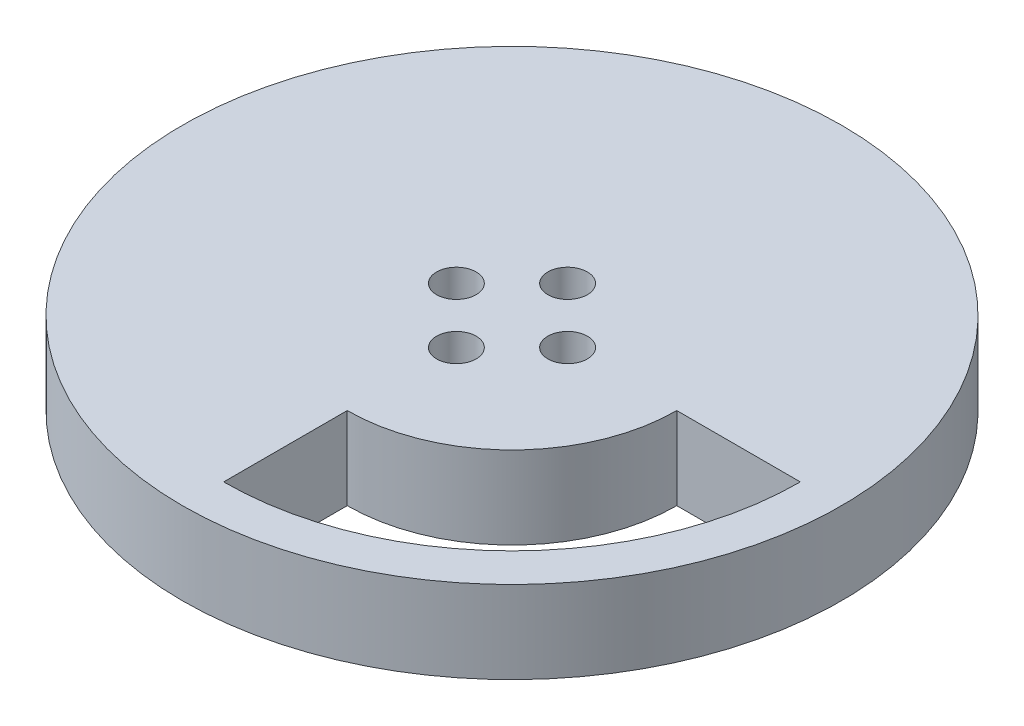
from build123d import *

# Parameters (mm, degrees)
SKETCH_1_R          = 40
SKETCH_1_R_2        = 1.25
EXTRUDE_1_DEPTH     = 10
SKETCH_2_R          = 2.4
CUT_EXTRUDE_1_DEPTH = 6
CUT_EXTRUDE_2_DEPTH = 58.445626465


with BuildPart() as part:
    # 草图1 → 凸台-拉伸1 (new body)
    with BuildSketch(Plane(origin=(0, 0, 0), x_dir=(1, 0, 0), z_dir=(0, 1, 0))):
        with Locations(Location((0, 0, 0), (0, 0, 270))):
            Circle(SKETCH_1_R)
        with Locations(Location((6.75, 0, 0), (0, 0, 270))):
            Circle(SKETCH_1_R_2, mode=Mode.SUBTRACT)
        with Locations(Location((0, -6.75, 0), (0, 0, 270))):
            Circle(SKETCH_1_R_2, mode=Mode.SUBTRACT)
        with Locations(Location((-6.75, 0, 0), (0, 0, 270))):
            Circle(SKETCH_1_R_2, mode=Mode.SUBTRACT)
        with Locations(Location((0, 6.75, 0), (0, 0, 270))):
            Circle(SKETCH_1_R_2, mode=Mode.SUBTRACT)
    extrude(amount=EXTRUDE_1_DEPTH)

    # 草图2 → 切除-拉伸1 (cut)
    with BuildSketch(Plane(origin=(0, 10, 0), x_dir=(1, 0, 0), z_dir=(0, 1, 0))):
        with Locations(Location((0, 6.75, 0), (0, 0, 270))):
            Circle(SKETCH_2_R)
        with Locations(Location((6.75, 0, 0), (0, 0, 270))):
            Circle(SKETCH_2_R)
        with Locations(Location((0, -6.75, 0), (0, 0, 270))):
            Circle(SKETCH_2_R)
        with Locations(Location((-6.75, 0, 0), (0, 0, 270))):
            Circle(SKETCH_2_R)
    extrude(amount=-CUT_EXTRUDE_1_DEPTH, mode=Mode.SUBTRACT)

    # 草图3 → 切除-拉伸2 (cut, through all)
    with BuildSketch(Plane(origin=(0, 10, 0), x_dir=(1, 0, 0), z_dir=(0, 1, 0))):
        with BuildLine():
            Line((20, 0), (35, 0))
            ThreePointArc((35, 0), (24.748737342, -24.748737342), (0, -35))
            Line((0, -35), (0, -20))
            ThreePointArc((0, -20), (14.142135624, -14.142135624), (20, 0))
        make_face()
    extrude(amount=-CUT_EXTRUDE_2_DEPTH, mode=Mode.SUBTRACT)


solid = part.part
